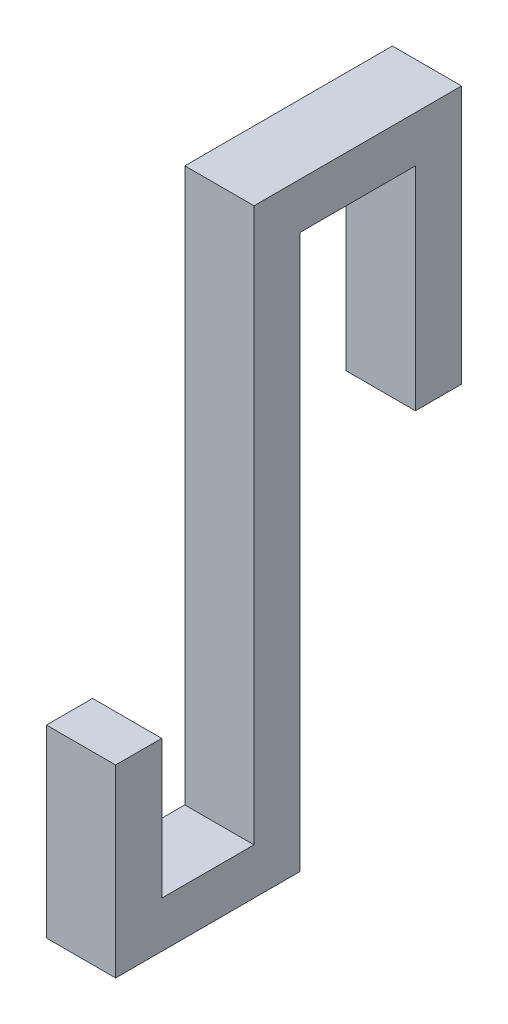
from build123d import *

# Parameters (mm, degrees)
BOSS_EXTRUDE1_DEPTH = 15


with BuildPart() as part:
    # Sketch1 → Boss-Extrude1 (new body)
    with BuildSketch(Plane(origin=(0, 0, 0), x_dir=(0, 0, -1), z_dir=(1, 0, 0))):
        Polygon((30.824095604, 67.060925147), (30.824095604, 21.060925147), (40.824095604, 21.060925147), (40.824095604, 77.060925147), (-4.175904396, 77.060925147), (-4.175904396, -52.939074853), (5.824095604, -52.939074853), (5.824095604, 67.060925147), align=None)
        Polygon((-4.175904396, -52.939074853), (-4.175904396, -42.939074853), (-24.175904396, -42.939074853), (-24.175904396, -12.939074853), (-34.175904396, -12.939074853), (-34.175904396, -52.939074853), align=None)
    extrude(amount=BOSS_EXTRUDE1_DEPTH)


solid = part.part
